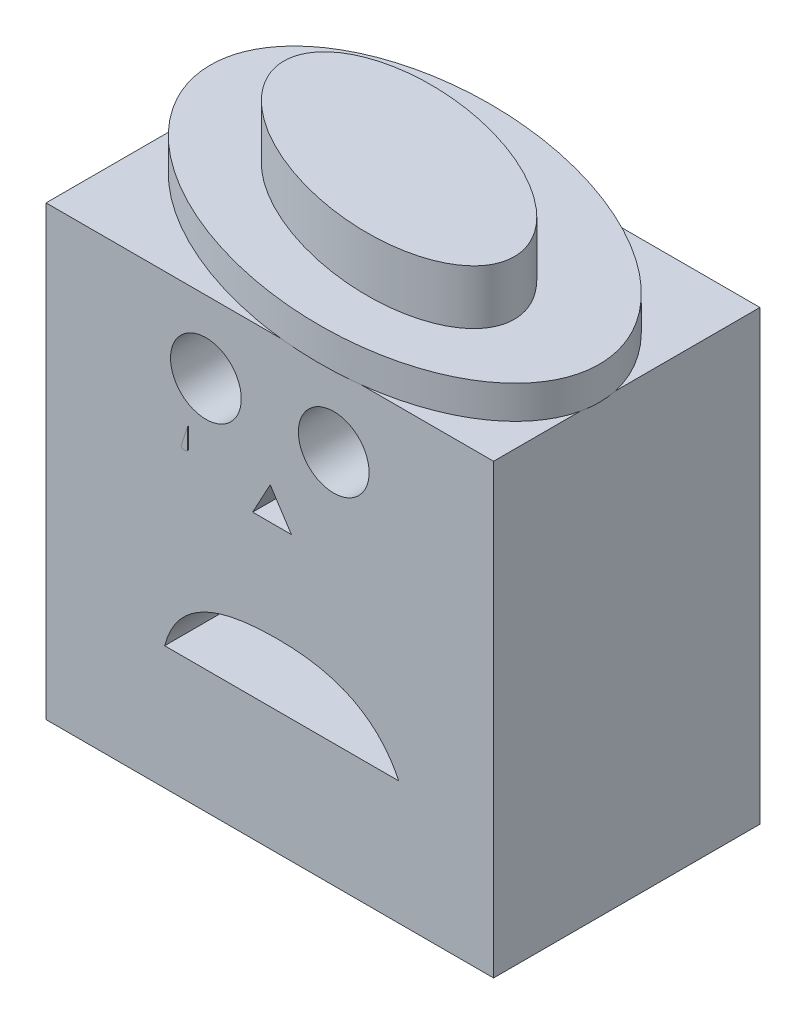
from build123d import *

# Parameters (mm, degrees)
SKETCH1_W           = 420
SKETCH1_H           = 420
SKETCH1_R           = 33.203133877
BOSS_EXTRUDE2_DEPTH = 250
BOSS_EXTRUDE3_DEPTH = 1
SKETCH4_RX          = 216.159218744
SKETCH4_RY          = 124.438636569
BOSS_EXTRUDE4_DEPTH = 31
SKETCH5_RX          = 136.808799133
SKETCH5_RY          = 69.0562156
BOSS_EXTRUDE5_DEPTH = 51


with BuildPart() as part:
    # Sketch1 → Boss-Extrude2 (new body)
    with BuildSketch(Plane.XY):
        with Locations((-1046.276969261, 563.504412843)):
            Rectangle(SKETCH1_W, SKETCH1_H)
        with Locations((-986.276969261, 705.792386227)):
            Circle(SKETCH1_R, mode=Mode.SUBTRACT)
        with Locations((-1106.276969261, 705.792386227)):
            Circle(SKETCH1_R, mode=Mode.SUBTRACT)
        Polygon((-1026.007137098, 619.07974314), (-1045.889944458, 649.563457617), (-1062.401956466, 619.07974314), align=None, mode=Mode.SUBTRACT)
        with BuildLine():
            Line((-1144.96201651, 469.201480292), (-925.225241317, 469.201480292))
            add(Edge.make_bspline(
                [(-1144.96201651, 469.201480292), (-1132.834759851, 516.055423689), (-1038.44686365, 538.622906956), (-948.523344563, 517.634809157), (-925.225241317, 469.201480292)],
                knots=[0, 0, 0, 0, 0.465700798, 1, 1, 1, 1], degree=3))
        make_face(mode=Mode.SUBTRACT)
    extrude(amount=BOSS_EXTRUDE2_DEPTH)

    # Sketch2 → Boss-Extrude3 (add)
    with BuildSketch(Plane.XY.offset(250)):
        with BuildLine():
            Line((-1122.462851099, 659.218542915), (-1128.539059101, 640.437536361))
            ThreePointArc((-1128.539059101, 640.437536361), (-1128.529323469, 639.793287222), (-1128.128635759, 639.288707105))
            add(Edge.make_bspline(
                [(-1128.128635759, 639.288707105), (-1127.290338361, 638.749430284), (-1125.582255263, 638.18298139), (-1123.857803216, 638.640795026), (-1122.979860291, 639.125064157)],
                knots=[0.103294074, 0.103294074, 0.103294074, 0.103294074, 0.51185707, 0.920052959, 0.920052959, 0.920052959, 0.920052959], degree=3))
            ThreePointArc((-1122.979860291, 639.125064157), (-1122.601749825, 639.492256106), (-1122.462851099, 640.000689579))
            Line((-1122.462851099, 640.000689579), (-1122.462851099, 659.218542915))
        make_face()
    extrude(amount=BOSS_EXTRUDE3_DEPTH)

    # Sketch4 → Boss-Extrude4 (add)
    with BuildSketch(Plane(origin=(0, 773.504412843, 0), x_dir=(1, 0, 0), z_dir=(0, 1, 0))):
        with Locations(Location((-1047.356098163, -122.204602032), (0, 0, 167.772053481))):
            Ellipse(SKETCH4_RX, SKETCH4_RY)
    extrude(amount=BOSS_EXTRUDE4_DEPTH)

    # Sketch5 → Boss-Extrude5 (add)
    with BuildSketch(Plane(origin=(0, 804.504412843, 0), x_dir=(1, 0, 0), z_dir=(0, 1, 0))):
        with Locations(Location((-1044.407129707, -130.546272111), (0, 0, -14.547039262))):
            Ellipse(SKETCH5_RX, SKETCH5_RY)
    extrude(amount=BOSS_EXTRUDE5_DEPTH)


solid = part.part
